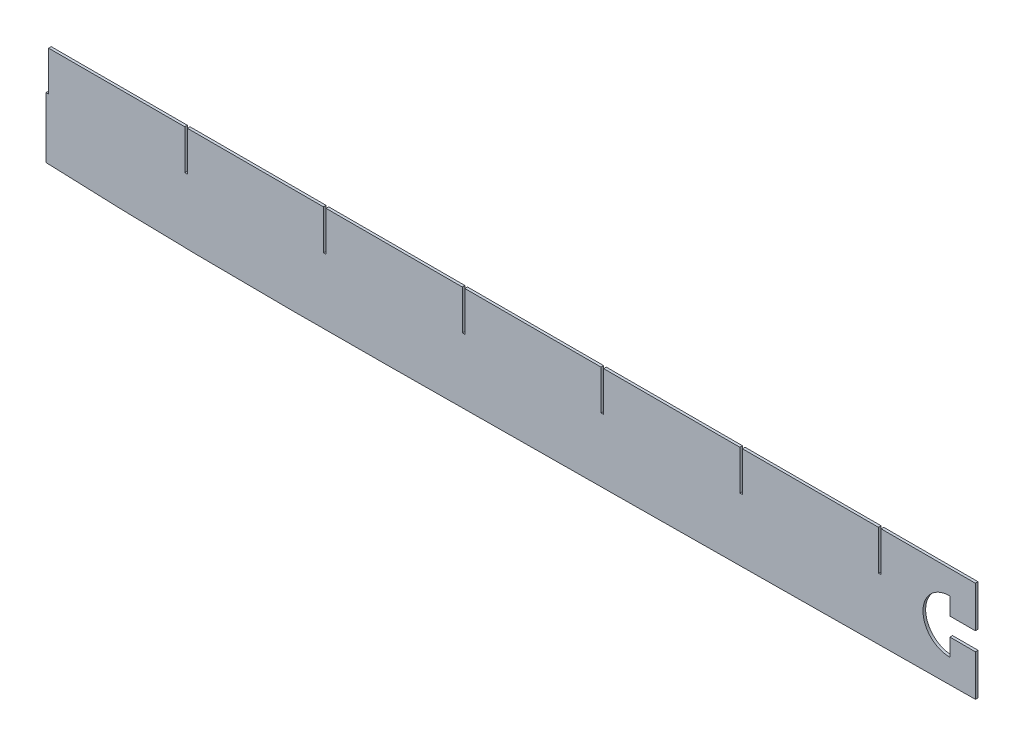
from build123d import *

# Parameters (mm, degrees)
BOSS_EXTRUDE1_DEPTH = 3


with BuildPart() as part:
    # Model → Boss-Extrude1 (new body)
    with BuildSketch(Plane.XY):
        with BuildLine():
            Line((1159.8, -200.422661621), (1159.8, -247.652661621))
            Line((1159.8, -247.652661621), (1130.6, -247.652661621))
            Line((1130.6, -247.652661621), (1130.6, -227.655293314))
            ThreePointArc((1130.6, -227.655293314), (1099.799999997, -258.052661621), (1130.6, -288.450029928))
            Line((1130.6, -288.450029928), (1130.6, -268.452661621))
            Line((1130.6, -268.452661621), (1159.8, -268.452661621))
            Line((1159.8, -268.452661621), (1159.8, -315.682652611))
            add(Edge.make_bspline(
                [(1159.8, -315.682652611), (982.299469587, -317.054252859), (804.800894245, -318.714261239), (449.798296518, -321.162775901), (272.233603405, -323.726378565), (94.901037796, -315.441313757)],
                knots=[0, 0, 0, 0, 0.5, 0.5, 1, 1, 1, 1], degree=3))
            Line((94.901037796, -315.441313757), (94.901037796, -245.979700014))
            Line((94.901037796, -245.979700014), (97.901037796, -245.979700014))
            Line((97.901037796, -245.979700014), (97.901037796, -200.422661621))
            Line((97.901037796, -200.422661621), (253.901037796, -200.422661621))
            Line((253.901037796, -200.422661621), (253.901037796, -245.979700014))
            Line((253.901037796, -245.979700014), (256.901037795, -245.979700014))
            Line((256.901037795, -245.979700014), (256.901037795, -200.422661621))
            Line((256.901037795, -200.422661621), (412.901037795, -200.422661621))
            Line((412.901037795, -200.422661621), (412.901037795, -245.979700014))
            Line((412.901037795, -245.979700014), (415.901037795, -245.979700014))
            Line((415.901037795, -245.979700014), (415.901037795, -200.422661621))
            Line((415.901037795, -200.422661621), (571.901037795, -200.422661621))
            Line((571.901037795, -200.422661621), (571.901037795, -245.979700014))
            Line((571.901037795, -245.979700014), (574.901037795, -245.979700014))
            Line((574.901037795, -245.979700014), (574.901037795, -200.422661621))
            Line((574.901037795, -200.422661621), (730.901037795, -200.422661621))
            Line((730.901037795, -200.422661621), (730.901037795, -245.979700014))
            Line((730.901037795, -245.979700014), (733.901037795, -245.979700014))
            Line((733.901037795, -245.979700014), (733.901037795, -200.422661621))
            Line((733.901037795, -200.422661621), (889.901037795, -200.422661621))
            Line((889.901037795, -200.422661621), (889.901037795, -245.979700014))
            Line((889.901037795, -245.979700014), (892.901037795, -245.979700014))
            Line((892.901037795, -245.979700014), (892.901037795, -200.422661621))
            Line((892.901037795, -200.422661621), (1048.901037796, -200.422661621))
            Line((1048.901037796, -200.422661621), (1048.901037796, -245.979700014))
            Line((1048.901037796, -245.979700014), (1051.901037795, -245.979700014))
            Line((1051.901037795, -245.979700014), (1051.901037795, -200.422661621))
            Line((1051.901037795, -200.422661621), (1159.8, -200.422661621))
        make_face()
    extrude(amount=BOSS_EXTRUDE1_DEPTH)


solid = part.part
